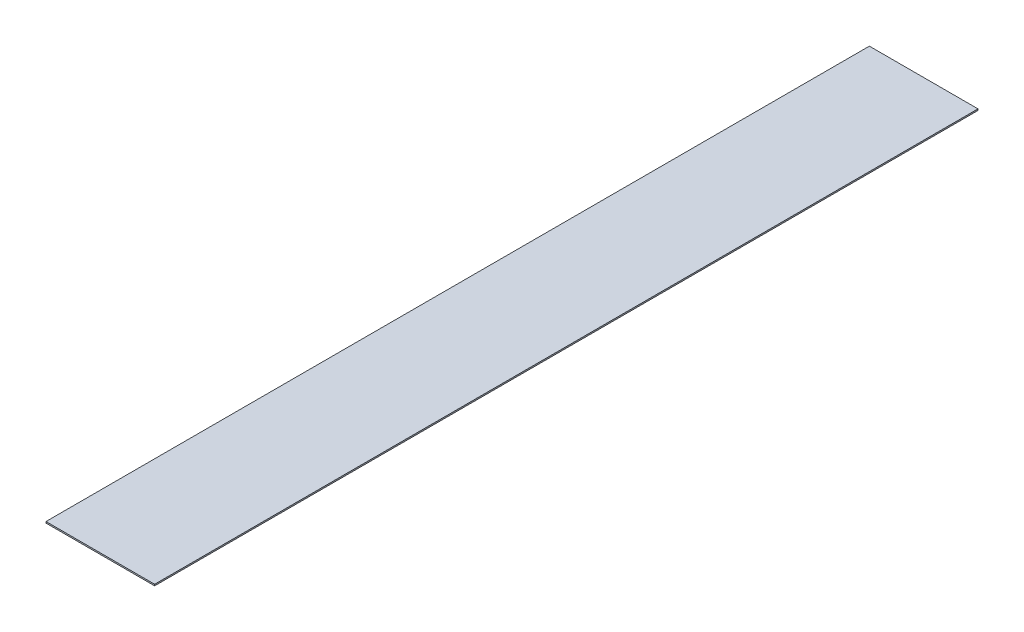
from build123d import *

# Parameters (mm, degrees)
SKETCH1_W           = 241.3
SKETCH1_H           = 3.175
BOSS_EXTRUDE1_DEPTH = 1828.8


with BuildPart() as part:
    # Sketch1 → Boss-Extrude1 (new body)
    with BuildSketch(Plane.XY):
        Rectangle(SKETCH1_W, SKETCH1_H)
    extrude(amount=BOSS_EXTRUDE1_DEPTH)


solid = part.part
